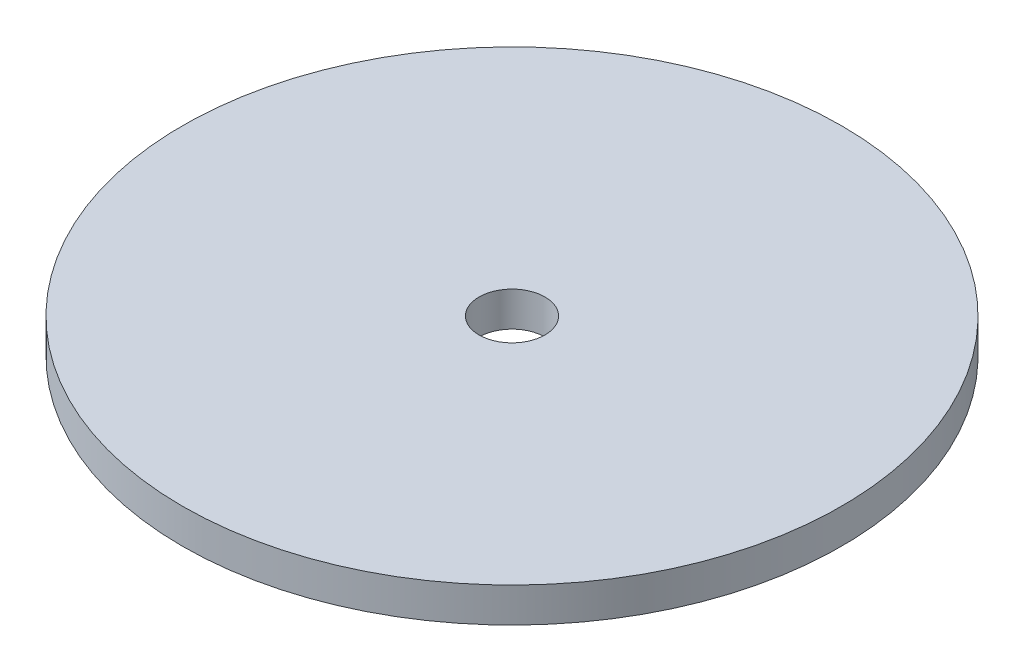
from build123d import *

# Parameters (mm, degrees)
SKETCH1_R           = 48.26
SKETCH1_R_2         = 4.826
BOSS_EXTRUDE1_DEPTH = 5.08


with BuildPart() as part:
    # Sketch1 → Boss-Extrude1 (new body)
    with BuildSketch(Plane(origin=(0, 0, 0), x_dir=(1, 0, 0), z_dir=(0, 1, 0))):
        with Locations(Location((0, 0, 0), (0, 0, 270))):
            Circle(SKETCH1_R)
        with Locations(Location((0, 0, 0), (0, 0, 270))):
            Circle(SKETCH1_R_2, mode=Mode.SUBTRACT)
    extrude(amount=BOSS_EXTRUDE1_DEPTH)


solid = part.part
